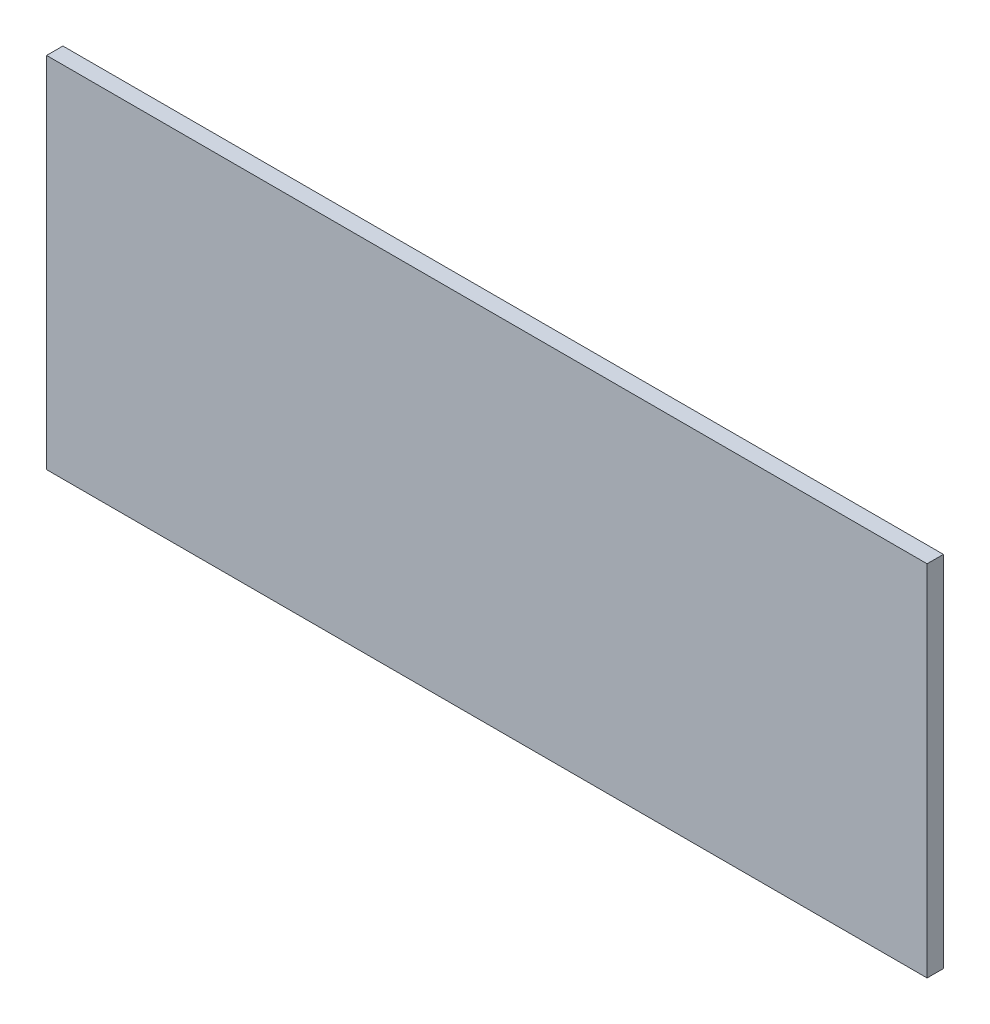
from build123d import *

# Parameters (mm, degrees)
SKETCH1_W           = 110
SKETCH1_H           = 270
BOSS_EXTRUDE1_DEPTH = 5


with BuildPart() as part:
    # Sketch1 → Boss-Extrude1 (new body)
    with BuildSketch(Plane(origin=(0, 0, 0), x_dir=(0, 1, 0), z_dir=(0, 0, 1))):
        with Locations((55, 135)):
            Rectangle(SKETCH1_W, SKETCH1_H)
    extrude(amount=BOSS_EXTRUDE1_DEPTH)


solid = part.part
